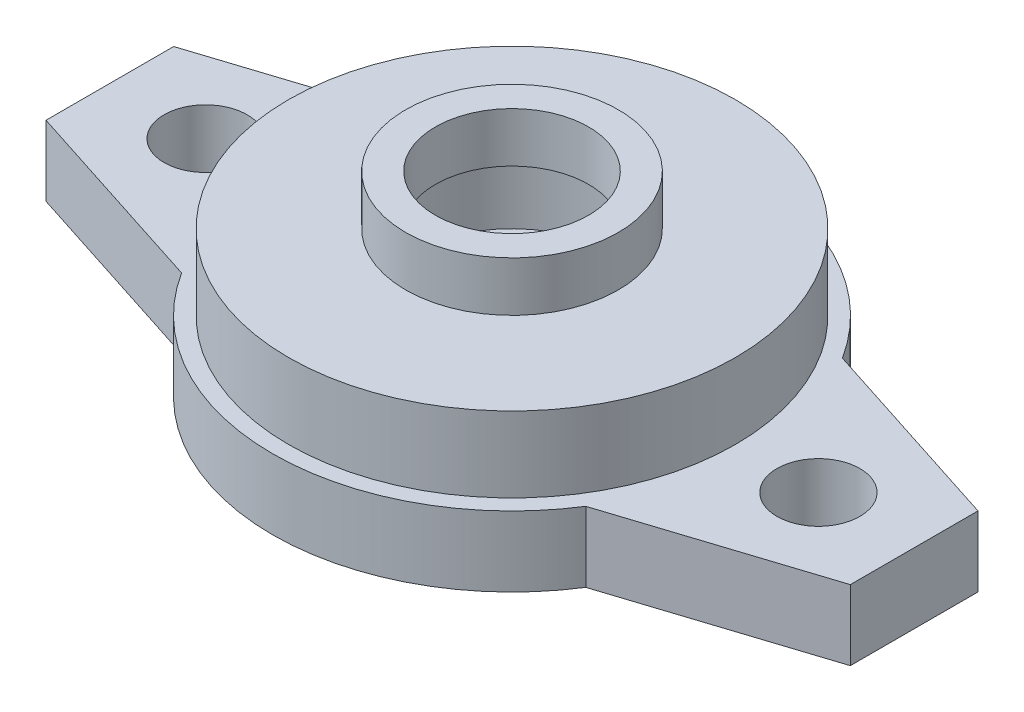
from build123d import *

# Parameters (mm, degrees)
SKETCH1_R           = 18.75
SKETCH1_R_2         = 6
SKETCH1_R_3         = 3.25
BOSS_EXTRUDE1_DEPTH = 5.5
SKETCH2_R           = 17.5
SKETCH2_R_2         = 8.33
BOSS_EXTRUDE2_DEPTH = 5.9
SKETCH3_R           = 8.33
SKETCH3_R_2         = 6
BOSS_EXTRUDE3_DEPTH = 3.9


with BuildPart() as part:
    # Sketch1 → Boss-Extrude1 (new body)
    # profile 1 of 3: a face of its own
    with BuildSketch(Plane(origin=(0, 0, 0), x_dir=(1, 0, 0), z_dir=(0, 1, 0))):
        Circle(SKETCH1_R)
        with Locations(Location((0, 0, 0), (0, 0, 270))):
            Circle(SKETCH1_R_2, mode=Mode.SUBTRACT)
    # profile 2 of 3: a face of its own
    with BuildSketch(Plane(origin=(0, 0, 0), x_dir=(1, 0, 0), z_dir=(0, 1, 0))):
        with BuildLine():
            ThreePointArc((-15.82908715, -10.05), (-18.75, 0), (-15.82908715, 10.05))
            Line((-15.82908715, 10.05), (-31.5, 5))
            Line((-31.5, 5), (-31.5, 0))
            Line((-31.5, 0), (-31.5, -5))
            Line((-31.5, -5), (-15.82908715, -10.05))
        make_face()
        with Locations(Location((-24, 0, 0), (0, 0, 270))):
            Circle(SKETCH1_R_3, mode=Mode.SUBTRACT)
    # profile 3 of 3: a face of its own
    with BuildSketch(Plane(origin=(0, 0, 0), x_dir=(1, 0, 0), z_dir=(0, 1, 0))):
        with BuildLine():
            Line((31.5, -5), (31.5, 0))
            Line((31.5, 0), (31.5, 5))
            Line((31.5, 5), (15.82908715, 10.05))
            ThreePointArc((15.82908715, 10.05), (18.004969926, 5.232930151), (18.75, 0))
            ThreePointArc((18.75, 0), (18.004969926, -5.232930151), (15.82908715, -10.05))
            Line((15.82908715, -10.05), (31.5, -5))
        make_face()
        with Locations(Location((24, 0, 0), (0, 0, 270))):
            Circle(SKETCH1_R_3, mode=Mode.SUBTRACT)
    extrude(amount=BOSS_EXTRUDE1_DEPTH)

    # Sketch2 → Boss-Extrude2 (add)
    with BuildSketch(Plane(origin=(0, 5.5, 0), x_dir=(1, 0, 0), z_dir=(0, 1, 0))):
        with Locations(Location((0, 0, 0), (0, 0, 270))):
            Circle(SKETCH2_R)
        with Locations(Location((0, 0, 0), (0, 0, 270))):
            Circle(SKETCH2_R_2, mode=Mode.SUBTRACT)
    extrude(amount=BOSS_EXTRUDE2_DEPTH)


with BuildPart() as body_2:
    # Sketch3 → Boss-Extrude3 (new body)
    with BuildSketch(Plane(origin=(0, 11.4, 0), x_dir=(1, 0, 0), z_dir=(0, 1, 0))):
        with Locations(Location((0, 0, 0), (0, 0, 270))):
            Circle(SKETCH3_R)
        with Locations(Location((0, 0, 0), (0, 0, 270))):
            Circle(SKETCH3_R_2, mode=Mode.SUBTRACT)
    extrude(amount=BOSS_EXTRUDE3_DEPTH)


solid = Compound([part.part, body_2.part])
